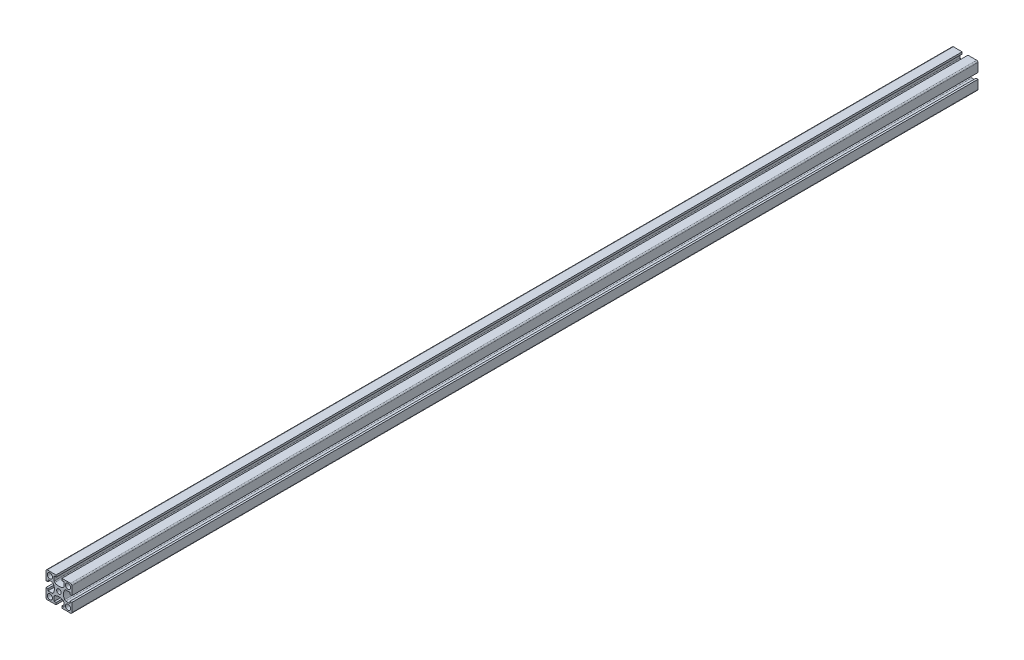
from build123d import *

# Parameters (mm, degrees)
SKETCH1_R           = 2
SKETCH1_R_2         = 1.75
BOSS_EXTRUDE1_DEPTH = 700


with BuildPart() as part:
    # Sketch1 → Boss-Extrude1 (new body)
    with BuildSketch(Plane.XY):
        with BuildLine():
            Line((-10, 9), (-10, 2.25))
            Line((-10, 2.25), (-8.5, 2.25))
            Line((-8.5, 2.25), (-8.5, 3.75))
            Line((-8.5, 3.75), (-5.236860279, 3.75))
            ThreePointArc((-5.236860279, 3.75), (-4.736860279, 3.616025404), (-4.370834875, 3.25))
            ThreePointArc((-4.370834875, 3.25), (-3.5, 0), (-4.370834875, -3.25))
            ThreePointArc((-4.370834875, -3.25), (-4.736860279, -3.616025404), (-5.236860279, -3.75))
            Line((-5.236860279, -3.75), (-8.5, -3.75))
            Line((-8.5, -3.75), (-8.5, -2.25))
            Line((-8.5, -2.25), (-10, -2.25))
            Line((-10, -2.25), (-10, -9))
            ThreePointArc((-10, -9), (-9.707106781, -9.707106781), (-9, -10))
            Line((-9, -10), (-2.25, -10))
            Line((-2.25, -10), (-2.25, -8.5))
            Line((-2.25, -8.5), (-3.75, -8.5))
            Line((-3.75, -8.5), (-3.75, -5.236860279))
            ThreePointArc((-3.75, -5.236860279), (-3.616025404, -4.736860279), (-3.25, -4.370834875))
            ThreePointArc((-3.25, -4.370834875), (0, -3.5), (3.25, -4.370834875))
            ThreePointArc((3.25, -4.370834875), (3.616025404, -4.736860279), (3.75, -5.236860279))
            Line((3.75, -5.236860279), (3.75, -8.5))
            Line((3.75, -8.5), (2.25, -8.5))
            Line((2.25, -8.5), (2.25, -10))
            Line((2.25, -10), (9, -10))
            ThreePointArc((9, -10), (9.707106781, -9.707106781), (10, -9))
            Line((10, -9), (10, -2.25))
            Line((10, -2.25), (8.5, -2.25))
            Line((8.5, -2.25), (8.5, -3.75))
            Line((8.5, -3.75), (5.236860279, -3.75))
            ThreePointArc((5.236860279, -3.75), (4.736860279, -3.616025404), (4.370834875, -3.25))
            ThreePointArc((4.370834875, -3.25), (3.5, 0), (4.370834875, 3.25))
            ThreePointArc((4.370834875, 3.25), (4.736860279, 3.616025404), (5.236860279, 3.75))
            Line((5.236860279, 3.75), (8.5, 3.75))
            Line((8.5, 3.75), (8.5, 2.25))
            Line((8.5, 2.25), (10, 2.25))
            Line((10, 2.25), (10, 9))
            ThreePointArc((10, 9), (9.707106781, 9.707106781), (9, 10))
            Line((9, 10), (2.25, 10))
            Line((2.25, 10), (2.25, 8.5))
            Line((2.25, 8.5), (3.75, 8.5))
            Line((3.75, 8.5), (3.75, 5.236860279))
            ThreePointArc((3.75, 5.236860279), (3.616025404, 4.736860279), (3.25, 4.370834875))
            ThreePointArc((3.25, 4.370834875), (0, 3.5), (-3.25, 4.370834875))
            ThreePointArc((-3.25, 4.370834875), (-3.616025404, 4.736860279), (-3.75, 5.236860279))
            Line((-3.75, 5.236860279), (-3.75, 8.5))
            Line((-3.75, 8.5), (-2.25, 8.5))
            Line((-2.25, 8.5), (-2.25, 10))
            Line((-2.25, 10), (-9, 10))
            ThreePointArc((-9, 10), (-9.707106781, 9.707106781), (-10, 9))
        make_face()
        with Locations((-7, -7)):
            Circle(SKETCH1_R, mode=Mode.SUBTRACT)
        with Locations((7, -7)):
            Circle(SKETCH1_R, mode=Mode.SUBTRACT)
        with Locations((7, 7)):
            Circle(SKETCH1_R, mode=Mode.SUBTRACT)
        Circle(SKETCH1_R_2, mode=Mode.SUBTRACT)
        with Locations((-7, 7)):
            Circle(SKETCH1_R, mode=Mode.SUBTRACT)
    extrude(amount=BOSS_EXTRUDE1_DEPTH)


solid = part.part
